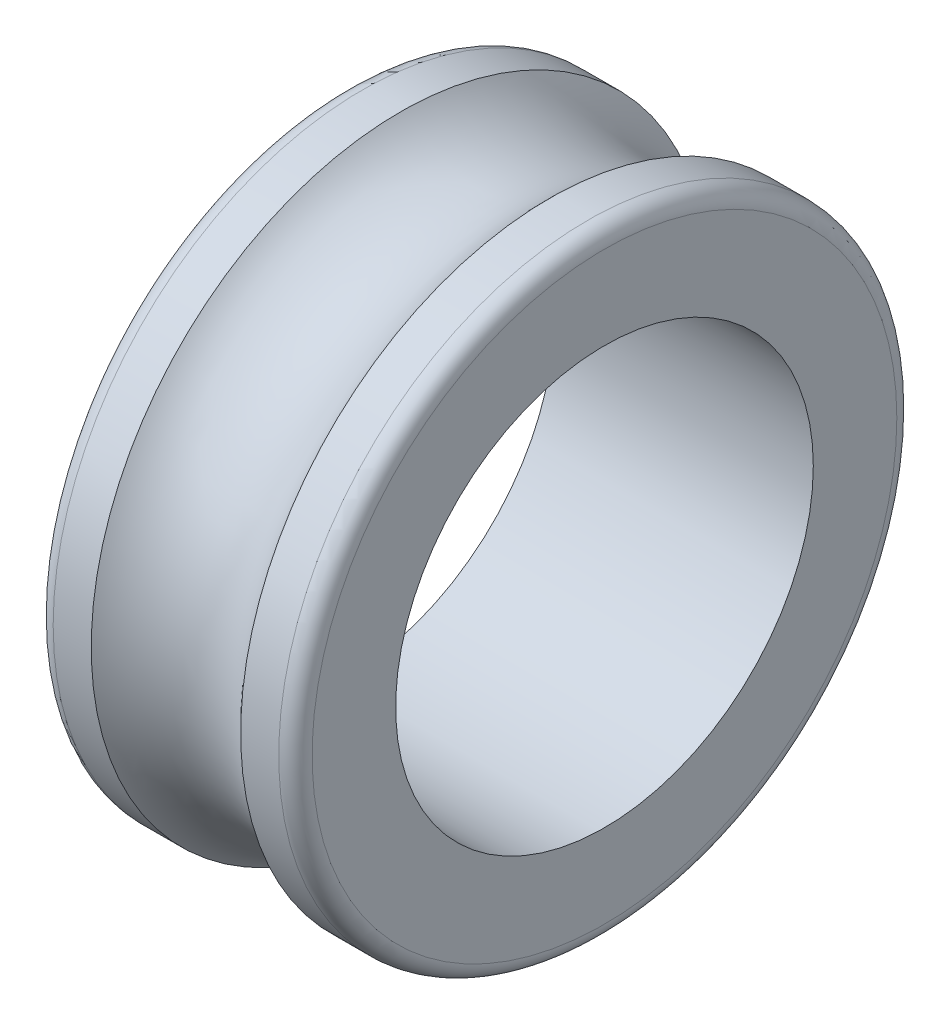
from build123d import *

# Parameters (mm, degrees)
FILLET_1_R = 2


with BuildPart() as part:
    # 草图1 → 旋转1 (revolve)
    with BuildSketch(Plane.XY, mode=Mode.PRIVATE) as revolve_1_sk:
        with BuildLine():
            Line((8.94427191, 37), (15.5, 37))
            Line((15.5, 37), (15.5, 25))
            Line((15.5, 25), (-15.5, 25))
            Line((-15.5, 25), (-15.5, 37))
            Line((-15.5, 37), (-8.94427191, 37))
            ThreePointArc((-8.94427191, 37), (0, 33), (8.94427191, 37))
        make_face()
    revolve(revolve_1_sk.sketch.rotate(Axis((34.957446809, 0, 0), (-1, 0, 0)), 90), axis=Axis((34.957446809, 0, 0), (-1, 0, 0)))

    # 圆角1
    fillet_1_edges = [part.edges().sort_by_distance(p)[0] for p in [
        (-15.5, 0, 37),
        (15.5, 0, 37),
    ]]
    fillet(fillet_1_edges, radius=FILLET_1_R)


solid = part.part
